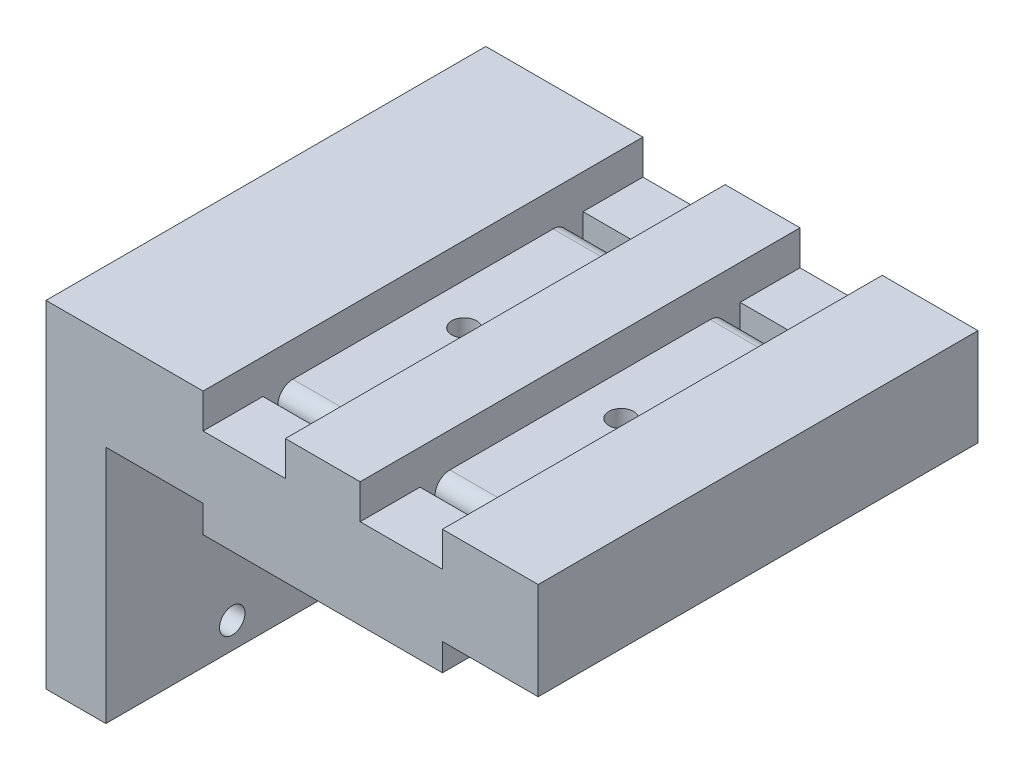
from build123d import *

# Parameters (mm, degrees)
SKETCH1_W                       = 57.8
SKETCH1_H                       = 58.8
BOSS_EXTRUDE1_DEPTH             = 7
SKETCH5_W                       = 57.8
SKETCH5_H                       = 58.8
BOSS_EXTRUDE2_DEPTH             = 6
SKETCH6_W                       = 58.8
SKETCH6_H                       = 45
BOSS_EXTRUDE3_DEPTH             = 8
CBORE_FOR_M3_SHCS2_D            = 3.4
CBORE_FOR_M3_SHCS2_CBORE_D      = 6.5
CBORE_FOR_M3_SHCS2_CBORE_DEPTH  = 3
SKETCH10_W                      = 32
SKETCH10_H                      = 58.8
BOSS_EXTRUDE4_DEPTH             = 3.63
CUT_EXTRUDE1_START              = -4.63
SKETCH11_W                      = 32
SKETCH11_H                      = 8
CUT_EXTRUDE1_DEPTH              = 4.63
SKETCH12_W                      = 32
SKETCH12_H                      = 2
CUT_EXTRUDE2_DEPTH              = 63.094338711
SKETCH17_W                      = 32
SKETCH17_H                      = 58.8
CUT_EXTRUDE3_DEPTH              = 20
BOSS_EXTRUDE5_REACH             = 64.094
SKETCH18_W                      = 10
SKETCH18_H                      = 58.8
BOSS_EXTRUDE5_DIRECTION_2_REACH = 64.094
FILLET1_R                       = 2
M4X0_7_TAPPED_HOLE1_D           = 3.3


with BuildPart() as part:
    # Sketch1 → Boss-Extrude1 (new body)
    with BuildSketch(Plane(origin=(0, 0, 0), x_dir=(1, 0, 0), z_dir=(0, 1, 0))):
        Rectangle(SKETCH1_W, SKETCH1_H)
    extrude(amount=BOSS_EXTRUDE1_DEPTH)

    # Sketch5 → Boss-Extrude2 (add)
    with BuildSketch(Plane.XZ):
        Rectangle(SKETCH5_W, SKETCH5_H)
    extrude(amount=BOSS_EXTRUDE2_DEPTH)

    # Sketch6 → Boss-Extrude3 (add)
    with BuildSketch(Plane.ZY.offset(28.9)):
        with Locations((0, -15.5)):
            Rectangle(SKETCH6_W, SKETCH6_H)
    extrude(amount=BOSS_EXTRUDE3_DEPTH)

    # CBORE for M3 SHCS2 (through all)
    with Locations(Plane.ZY.offset(36.9)):
        with Locations((-12.5, -9.5), (12.5, -9.5), (12.5, -34.5), (-12.5, -34.5)):
            CounterBoreHole(CBORE_FOR_M3_SHCS2_D / 2, CBORE_FOR_M3_SHCS2_CBORE_D / 2, CBORE_FOR_M3_SHCS2_CBORE_DEPTH)

    # Sketch10 → Boss-Extrude4 (add)
    with BuildSketch(Plane.XZ.offset(6)):
        with Locations((0.1, 0)):
            Rectangle(SKETCH10_W, SKETCH10_H)
    extrude(amount=BOSS_EXTRUDE4_DEPTH)

    # Sketch11 → Cut-Extrude1 (cut)
    with BuildSketch(Plane(origin=(0, 7, 0), x_dir=(1, 0, 0), z_dir=(0, 1, 0)).offset(CUT_EXTRUDE1_START)):
        with Locations((0.1, -25.4)):
            Rectangle(SKETCH11_W, SKETCH11_H)
    cut_extrude1 = extrude(amount=CUT_EXTRUDE1_DEPTH, mode=Mode.SUBTRACT)

    # Sketch12 → Cut-Extrude2 (cut, symmetric)
    with BuildSketch(Plane(origin=(0, 2.37, 0), x_dir=(1, 0, 0), z_dir=(0, 1, 0))):
        with Locations((0.1, -20.4)):
            Rectangle(SKETCH12_W, SKETCH12_H)
    cut_extrude2 = extrude(amount=CUT_EXTRUDE2_DEPTH, both=True, mode=Mode.SUBTRACT)

    # Mirror1: Cut-Extrude1, Cut-Extrude2 across plane
    add(cut_extrude1.mirror(Plane.XY), mode=Mode.SUBTRACT)
    add(cut_extrude2.mirror(Plane.XY), mode=Mode.SUBTRACT)

    # Sketch17 → Cut-Extrude3 (cut)
    with BuildSketch(Plane(origin=(0, 2.37, 0), x_dir=(1, 0, 0), z_dir=(0, 1, 0))):
        with Locations((0.1, 0)):
            Rectangle(SKETCH17_W, SKETCH17_H)
    extrude(amount=CUT_EXTRUDE3_DEPTH, mode=Mode.SUBTRACT)

    # Boss-Extrude5: up to this face of the body (flat: up to its plane)
    boss_extrude5_end = Plane(part.part.faces().sort_by_distance((22.5, 7, 0))[0])
    # Sketch18 → Boss-Extrude5 (add, up to the picked face)
    with BuildSketch(Plane(origin=(0, 2.37, 0), x_dir=(1, 0, 0), z_dir=(0, 1, 0)), mode=Mode.PRIVATE) as boss_extrude5_sk1:
        with Locations((0.1, 0)):
            Rectangle(SKETCH18_W, SKETCH18_H)
    boss_extrude5_tool1 = split(extrude(boss_extrude5_sk1.sketch, amount=BOSS_EXTRUDE5_REACH, mode=Mode.PRIVATE), bisect_by=boss_extrude5_end, keep=Keep.BOTH, mode=Mode.PRIVATE)
    add(boss_extrude5_tool1.solids().sort_by(Axis((0.1, 2.37, 0), (0, 1, 0)))[0])

    # Boss-Extrude5 direction 2: up to this face of the body (flat: up to its plane)
    boss_extrude5_direction_2_end = Plane(part.part.faces().sort_by_distance((0.1, -9.63, 0))[0])
    # Sketch18 → Boss-Extrude5 direction 2 (add, up to the picked face)
    with BuildSketch(Plane(origin=(0, 2.37, 0), x_dir=(1, 0, 0), z_dir=(0, 1, 0)), mode=Mode.PRIVATE) as boss_extrude5_direction_2_sk1:
        with Locations((0.1, 0)):
            Rectangle(SKETCH18_W, SKETCH18_H)
    boss_extrude5_direction_2_tool1 = split(extrude(boss_extrude5_direction_2_sk1.sketch, amount=-BOSS_EXTRUDE5_DIRECTION_2_REACH, mode=Mode.PRIVATE), bisect_by=boss_extrude5_direction_2_end, keep=Keep.BOTH, mode=Mode.PRIVATE)
    add(boss_extrude5_direction_2_tool1.solids().sort_by(Axis((0.1, 2.37, 0), (0, -1, 0)))[0])

    # Fillet1
    fillet1_edges = [part.edges().sort_by_distance(p)[0] for p in [
        (10.6, -9.63, 21.4),
        (10.6, -9.63, -21.4),
        (10.6, 2.37, -19.4),
        (10.6, 2.37, 19.4),
        (-10.4, 2.37, -19.4),
        (-10.4, 2.37, 19.4),
        (-10.4, -9.63, -21.4),
        (-10.4, -9.63, 21.4),
    ]]
    fillet(fillet1_edges, radius=FILLET1_R)

    # M4x0.7 Tapped Hole1 (through all)
    with Locations(Plane(origin=(0, 2.37, 0), x_dir=(1, 0, 0), z_dir=(0, 1, 0))):
        with Locations((-10.4, 0), (10.6, 0)):
            Hole(M4X0_7_TAPPED_HOLE1_D / 2)


solid = part.part
